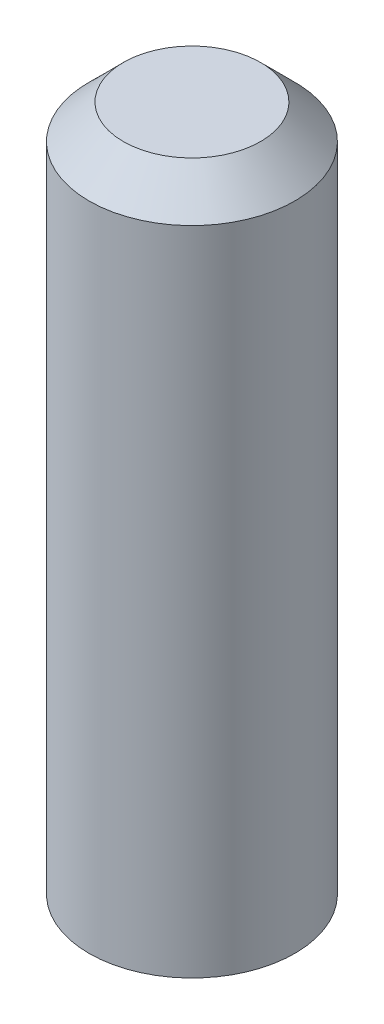
from build123d import *

# Parameters (mm, degrees)
SKETCH_1_R      = 1.5
EXTRUDE_1_DEPTH = 10
CHAMFER_1_SIZE  = 0.5


with BuildPart() as part:
    # Эскиз1 → Бобышка-Вытянуть1 (new body)
    with BuildSketch(Plane(origin=(0, 0, 0), x_dir=(1, 0, 0), z_dir=(0, 1, 0))):
        with Locations(Location((0, 0, 0), (0, 0, 270))):
            Circle(SKETCH_1_R)
    extrude(amount=EXTRUDE_1_DEPTH)

    # Фаска1
    chamfer_1_edges = [part.edges().sort_by_distance(p)[0] for p in [
        (0, 10, -1.5),
    ]]
    chamfer(chamfer_1_edges, length=CHAMFER_1_SIZE)


solid = part.part
